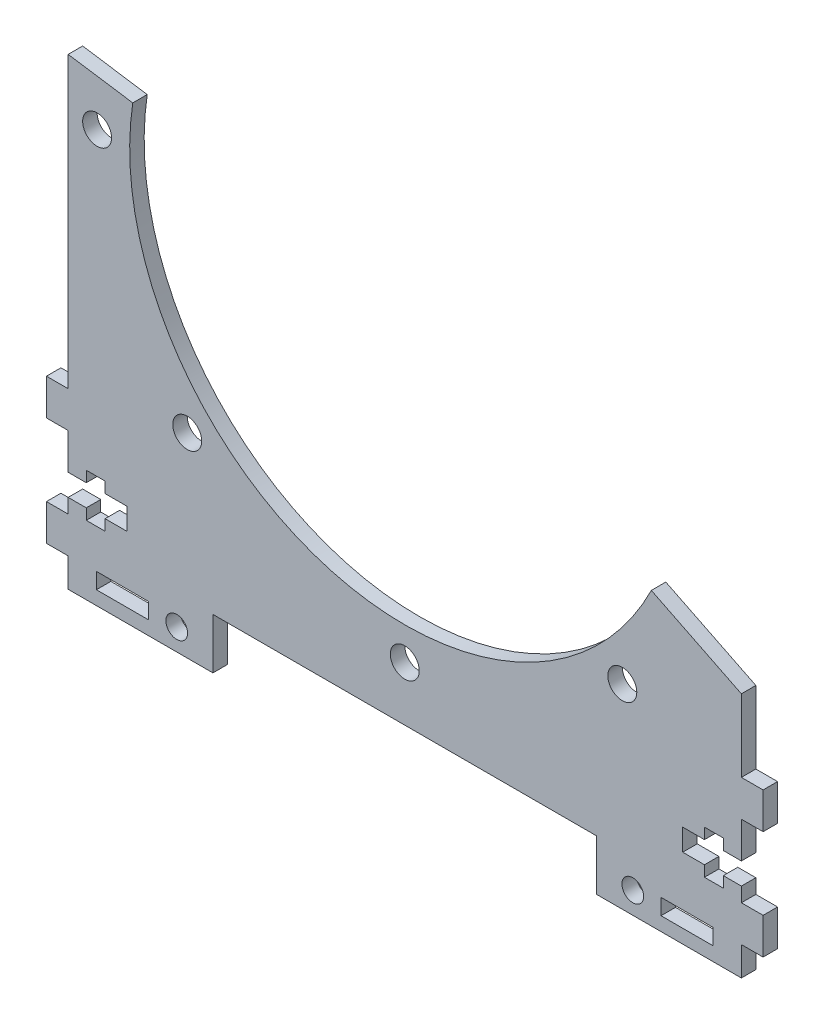
from build123d import *

# Parameters (mm, degrees)
SKETCH_3_R      = 1.5
SKETCH_3_R_2    = 2
SKETCH_3_W      = 7.2
SKETCH_3_H      = 2.2
EXTRUDE_1_DEPTH = 2


with BuildPart() as part:
    # 草图3 → 凸台-拉伸1 (new body)
    with BuildSketch(Plane.XY):
        with BuildLine():
            Line((-46.5, 0.009783315), (-46.5, -3.990216685))
            Line((-46.5, -3.990216685), (-26.5, -3.990216685))
            Line((-26.5, -3.990216685), (-26.5, 3.009783315))
            Line((-26.5, 3.009783315), (26.5, 3.009783315))
            Line((26.5, 3.009783315), (26.5, -3.990216685))
            Line((26.5, -3.990216685), (46.5, -3.990216685))
            Line((46.5, -3.990216685), (46.5, 0.009783315))
            Line((46.5, 0.009783315), (49.5, 0.009783315))
            Line((49.5, 0.009783315), (49.5, 5.009783315))
            Line((49.5, 5.009783315), (46.5, 5.009783315))
            Line((46.5, 5.009783315), (46.5, 7.009783315))
            Line((46.5, 7.009783315), (44, 7.009783315))
            Line((44, 7.009783315), (44, 5.509783315))
            Line((44, 5.509783315), (41.4, 5.509783315))
            Line((41.4, 5.509783315), (41.4, 7.009783315))
            Line((41.4, 7.009783315), (38.4, 7.009783315))
            Line((38.4, 7.009783315), (38.4, 10.009783315))
            Line((38.4, 10.009783315), (41.4, 10.009783315))
            Line((41.4, 10.009783315), (41.4, 11.509783315))
            Line((41.4, 11.509783315), (44, 11.509783315))
            Line((44, 11.509783315), (44, 10.009783315))
            Line((44, 10.009783315), (46.5, 10.009783315))
            Line((46.5, 10.009783315), (46.5, 15.009783315))
            Line((46.5, 15.009783315), (49.5, 15.009783315))
            Line((49.5, 15.009783315), (49.5, 20.009783315))
            Line((49.5, 20.009783315), (46.5, 20.009783315))
            Line((46.5, 20.009783315), (46.5, 30.009783315))
            Line((46.5, 30.009783315), (34.06116735, 36.162324196))
            ThreePointArc((34.06116735, 36.162324196), (-11.38853896, 16.756491321), (-37.576612526, 58.666477673))
            Line((-37.576612526, 58.666477673), (-46.5, 60.009783315))
            Line((-46.5, 60.009783315), (-46.5, 20.009783315))
            Line((-46.5, 20.009783315), (-49.5, 20.009783315))
            Line((-49.5, 20.009783315), (-49.5, 15.009783315))
            Line((-49.5, 15.009783315), (-46.5, 15.009783315))
            Line((-46.5, 15.009783315), (-46.5, 10.009783315))
            Line((-46.5, 10.009783315), (-44, 10.009783315))
            Line((-44, 10.009783315), (-44, 11.509783315))
            Line((-44, 11.509783315), (-41.4, 11.509783315))
            Line((-41.4, 11.509783315), (-41.4, 10.009783315))
            Line((-41.4, 10.009783315), (-38.4, 10.009783315))
            Line((-38.4, 10.009783315), (-38.4, 7.009783315))
            Line((-38.4, 7.009783315), (-41.4, 7.009783315))
            Line((-41.4, 7.009783315), (-41.4, 5.509783315))
            Line((-41.4, 5.509783315), (-44, 5.509783315))
            Line((-44, 5.509783315), (-44, 7.009783315))
            Line((-44, 7.009783315), (-46.5, 7.009783315))
            Line((-46.5, 7.009783315), (-46.5, 5.009783315))
            Line((-46.5, 5.009783315), (-49.5, 5.009783315))
            Line((-49.5, 5.009783315), (-49.5, 0.009783315))
            Line((-49.5, 0.009783315), (-46.5, 0.009783315))
        make_face()
        with Locations((-31.5, -0.990216685)):
            Circle(SKETCH_3_R, mode=Mode.SUBTRACT)
        with Locations((31.5, -0.990216685)):
            Circle(SKETCH_3_R, mode=Mode.SUBTRACT)
        with Locations((0, 10.509783315)):
            Circle(SKETCH_3_R_2, mode=Mode.SUBTRACT)
        with Locations((-30.0520382, 22.957745114)):
            Circle(SKETCH_3_R_2, mode=Mode.SUBTRACT)
        with Locations((-42.5, 53.009783315)):
            Circle(SKETCH_3_R_2, mode=Mode.SUBTRACT)
        with Locations((30.0520382, 22.957745114)):
            Circle(SKETCH_3_R_2, mode=Mode.SUBTRACT)
        with Locations((-39, -0.990216685)):
            Rectangle(SKETCH_3_W, SKETCH_3_H, mode=Mode.SUBTRACT)
        with Locations((39, -0.990216685)):
            Rectangle(SKETCH_3_W, SKETCH_3_H, mode=Mode.SUBTRACT)
    extrude(amount=EXTRUDE_1_DEPTH)


solid = part.part
